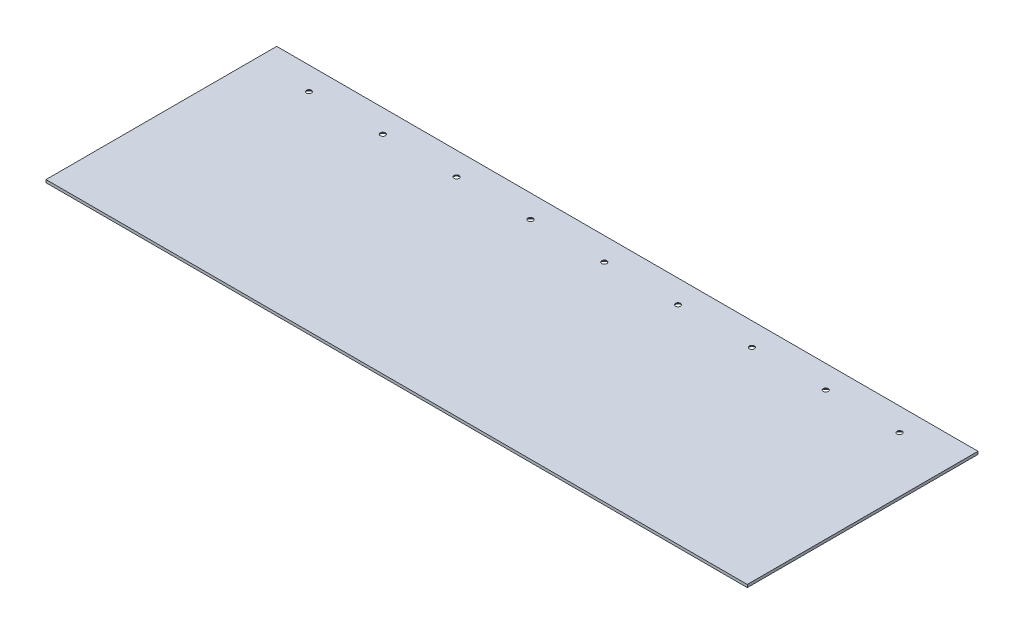
from build123d import *

# Parameters (mm, degrees)
SKETCH1_W                                    = 760
SKETCH1_H                                    = 250
BOSS_EXTRUDE1_DEPTH                          = 3
CSK_FOR_M5_COUNTERSUNK_FLAT_HEAD_SCR_2_COUNT = 2
CSK_FOR_M5_COUNTERSUNK_FLAT_HEAD_SCR_2_PITCH = 80
CSK_FOR_M5_COUNTERSUNK_FLAT_HEAD_SCR_3_COUNT = 2
CSK_FOR_M5_COUNTERSUNK_FLAT_HEAD_SCR_3_PITCH = 160
CSK_FOR_M5_COUNTERSUNK_FLAT_HEAD_SCR_4_COUNT = 2
CSK_FOR_M5_COUNTERSUNK_FLAT_HEAD_SCR_4_PITCH = 240
CSK_FOR_M5_COUNTERSUNK_FLAT_HEAD_SCR_5_COUNT = 2
CSK_FOR_M5_COUNTERSUNK_FLAT_HEAD_SCR_5_PITCH = 320
CSK_FOR_M5_COUNTERSUNK_FLAT_HEAD_SCR_6_COUNT = 2
CSK_FOR_M5_COUNTERSUNK_FLAT_HEAD_SCR_6_PITCH = 80
CSK_FOR_M5_COUNTERSUNK_FLAT_HEAD_SCR_7_COUNT = 2
CSK_FOR_M5_COUNTERSUNK_FLAT_HEAD_SCR_7_PITCH = 160
CSK_FOR_M5_COUNTERSUNK_FLAT_HEAD_SCR_8_COUNT = 2
CSK_FOR_M5_COUNTERSUNK_FLAT_HEAD_SCR_8_PITCH = 240
CSK_FOR_M5_COUNTERSUNK_FLAT_HEAD_SCR_9_COUNT = 2
CSK_FOR_M5_COUNTERSUNK_FLAT_HEAD_SCR_9_PITCH = 320


with BuildPart() as part:
    # Sketch1 → Boss-Extrude1 (new body)
    with BuildSketch(Plane(origin=(0, 0, 0), x_dir=(1, 0, 0), z_dir=(0, 1, 0))):
        Rectangle(SKETCH1_W, SKETCH1_H)
    extrude(amount=BOSS_EXTRUDE1_DEPTH)

    # Sketch3 → CSK for M5 Countersunk Flat Head Screw1 (revolve, cut)
    with BuildSketch(Plane(origin=(0, 0, -100), x_dir=(0, 0, -1), z_dir=(1, 0, 0))):
        Polygon((0, 0), (0, 3), (2.75, 3), (2.75, 2.45), (5.2, 0), align=None)
    csk_for_m5_countersunk_flat_head_screw1 = revolve(axis=Axis((0, -6.35, -100), (0, 1, 0)), mode=Mode.SUBTRACT)

    # CSK for M5 Countersunk Flat Head Scr 2: CSK for M5 Countersunk Flat Head Screw1 ×2
    with Locations(*[(-i * CSK_FOR_M5_COUNTERSUNK_FLAT_HEAD_SCR_2_PITCH, 0, 0) for i in range(1, CSK_FOR_M5_COUNTERSUNK_FLAT_HEAD_SCR_2_COUNT)]):
        add(csk_for_m5_countersunk_flat_head_screw1, mode=Mode.SUBTRACT)

    # CSK for M5 Countersunk Flat Head Scr 3: CSK for M5 Countersunk Flat Head Screw1 ×2
    with Locations(*[(-i * CSK_FOR_M5_COUNTERSUNK_FLAT_HEAD_SCR_3_PITCH, 0, 0) for i in range(1, CSK_FOR_M5_COUNTERSUNK_FLAT_HEAD_SCR_3_COUNT)]):
        add(csk_for_m5_countersunk_flat_head_screw1, mode=Mode.SUBTRACT)

    # CSK for M5 Countersunk Flat Head Scr 4: CSK for M5 Countersunk Flat Head Screw1 ×2
    with Locations(*[(-i * CSK_FOR_M5_COUNTERSUNK_FLAT_HEAD_SCR_4_PITCH, 0, 0) for i in range(1, CSK_FOR_M5_COUNTERSUNK_FLAT_HEAD_SCR_4_COUNT)]):
        add(csk_for_m5_countersunk_flat_head_screw1, mode=Mode.SUBTRACT)

    # CSK for M5 Countersunk Flat Head Scr 5: CSK for M5 Countersunk Flat Head Screw1 ×2
    with Locations(*[(-i * CSK_FOR_M5_COUNTERSUNK_FLAT_HEAD_SCR_5_PITCH, 0, 0) for i in range(1, CSK_FOR_M5_COUNTERSUNK_FLAT_HEAD_SCR_5_COUNT)]):
        add(csk_for_m5_countersunk_flat_head_screw1, mode=Mode.SUBTRACT)

    # CSK for M5 Countersunk Flat Head Scr 6: CSK for M5 Countersunk Flat Head Screw1 ×2
    with Locations(*[(i * CSK_FOR_M5_COUNTERSUNK_FLAT_HEAD_SCR_6_PITCH, 0, 0) for i in range(1, CSK_FOR_M5_COUNTERSUNK_FLAT_HEAD_SCR_6_COUNT)]):
        add(csk_for_m5_countersunk_flat_head_screw1, mode=Mode.SUBTRACT)

    # CSK for M5 Countersunk Flat Head Scr 7: CSK for M5 Countersunk Flat Head Screw1 ×2
    with Locations(*[(i * CSK_FOR_M5_COUNTERSUNK_FLAT_HEAD_SCR_7_PITCH, 0, 0) for i in range(1, CSK_FOR_M5_COUNTERSUNK_FLAT_HEAD_SCR_7_COUNT)]):
        add(csk_for_m5_countersunk_flat_head_screw1, mode=Mode.SUBTRACT)

    # CSK for M5 Countersunk Flat Head Scr 8: CSK for M5 Countersunk Flat Head Screw1 ×2
    with Locations(*[(i * CSK_FOR_M5_COUNTERSUNK_FLAT_HEAD_SCR_8_PITCH, 0, 0) for i in range(1, CSK_FOR_M5_COUNTERSUNK_FLAT_HEAD_SCR_8_COUNT)]):
        add(csk_for_m5_countersunk_flat_head_screw1, mode=Mode.SUBTRACT)

    # CSK for M5 Countersunk Flat Head Scr 9: CSK for M5 Countersunk Flat Head Screw1 ×2
    with Locations(*[(i * CSK_FOR_M5_COUNTERSUNK_FLAT_HEAD_SCR_9_PITCH, 0, 0) for i in range(1, CSK_FOR_M5_COUNTERSUNK_FLAT_HEAD_SCR_9_COUNT)]):
        add(csk_for_m5_countersunk_flat_head_screw1, mode=Mode.SUBTRACT)


solid = part.part
